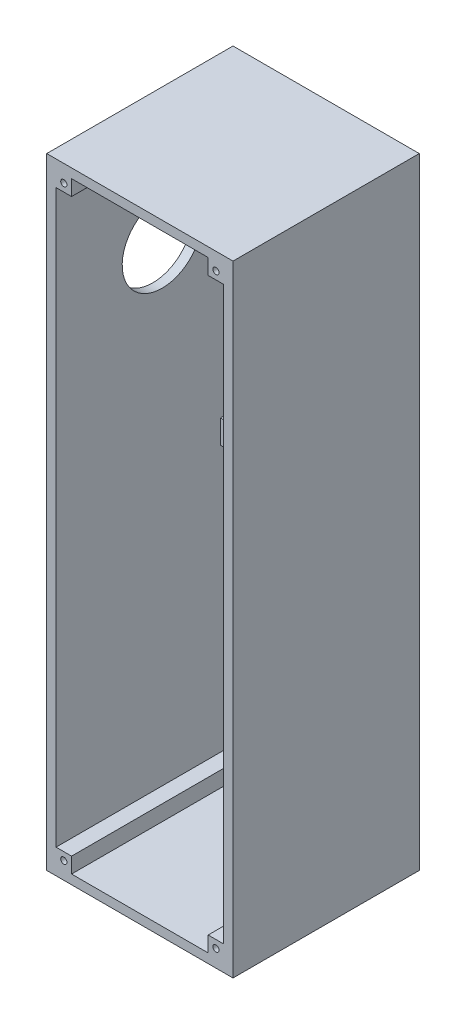
from build123d import *

# Parameters (mm, degrees)
SZKIC1_W                    = 60
SZKIC1_H                    = 60
DODANIE_WYCI_GNI_CIE1_DEPTH = 200
SKORUPA1_T                  = -3
SZKIC2_W                    = 5
SZKIC2_H                    = 5
SZKIC2_R                    = 1
DODANIE_WYCI_GNI_CIE5_DEPTH = 57
SZKIC3_W                    = 5
SZKIC3_H                    = 5
SZKIC3_R                    = 1
DODANIE_WYCI_GNI_CIE6_DEPTH = 57
SZKIC4_W                    = 5
SZKIC4_H                    = 5
SZKIC4_R                    = 1
DODANIE_WYCI_GNI_CIE7_DEPTH = 57
SZKIC5_W                    = 5
SZKIC5_H                    = 5
SZKIC5_R                    = 1
DODANIE_WYCI_GNI_CIE8_DEPTH = 57
SZKIC10_R                   = 12.875
WYTNIJ_WYCI_GNI_CIE3_DEPTH  = 3
SZKIC12_W                   = 31.15
SZKIC12_H                   = 7.6
DODANIE_WYCI_GNI_CIE9_DEPTH = 26.5
SZKIC13_R                   = 1.5
WYTNIJ_WYCI_GNI_CIE4_DEPTH  = 5
SZKIC15_R                   = 1.5
WYTNIJ_WYCI_GNI_CIE5_DEPTH  = 5
WYTNIJ_WYCI_GNI_CIE6_DEPTH  = 10
WYTNIJ_WYCI_GNI_CIE7_DEPTH  = 10


with BuildPart() as part:
    # Szkic1 → Dodanie-wyciągnięcie1 (new body)
    with BuildSketch(Plane(origin=(0, 0, 0), x_dir=(1, 0, 0), z_dir=(0, 1, 0))):
        with Locations((30, 30)):
            Rectangle(SZKIC1_W, SZKIC1_H)
    extrude(amount=DODANIE_WYCI_GNI_CIE1_DEPTH)

    # Skorupa1
    skorupa1_openings = [part.faces().sort_by_distance(p)[0] for p in [
        (30, 100, 0),
    ]]
    offset(amount=SKORUPA1_T, openings=skorupa1_openings, kind=Kind.INTERSECTION)

    # Szkic2 → Dodanie-wyciągnięcie5 (add)
    with BuildSketch(Plane.XY.offset(-57)):
        with Locations((5.5, 194.5)):
            Rectangle(SZKIC2_W, SZKIC2_H)
        with Locations(Location((5.5, 194.5, 0), (0, 0, 180))):
            Circle(SZKIC2_R, mode=Mode.SUBTRACT)
    extrude(amount=DODANIE_WYCI_GNI_CIE5_DEPTH)

    # Szkic3 → Dodanie-wyciągnięcie6 (add)
    with BuildSketch(Plane.XY.offset(-57)):
        with Locations((54.5, 194.5)):
            Rectangle(SZKIC3_W, SZKIC3_H)
        with Locations(Location((54.5, 194.5, 0), (0, 0, 180))):
            Circle(SZKIC3_R, mode=Mode.SUBTRACT)
    extrude(amount=DODANIE_WYCI_GNI_CIE6_DEPTH)

    # Szkic4 → Dodanie-wyciągnięcie7 (add)
    with BuildSketch(Plane.XY):
        with Locations((5.5, 5.5)):
            Rectangle(SZKIC4_W, SZKIC4_H)
        with Locations((5.5, 5.5)):
            Circle(SZKIC4_R, mode=Mode.SUBTRACT)
    extrude(amount=-DODANIE_WYCI_GNI_CIE7_DEPTH)

    # Szkic5 → Dodanie-wyciągnięcie8 (add)
    with BuildSketch(Plane.XY.offset(-57)):
        with Locations((54.5, 5.5)):
            Rectangle(SZKIC5_W, SZKIC5_H)
        with Locations(Location((54.5, 5.5, 0), (0, 0, 180))):
            Circle(SZKIC5_R, mode=Mode.SUBTRACT)
    extrude(amount=DODANIE_WYCI_GNI_CIE8_DEPTH)

    # Szkic10 → Wytnij-wyciągnięcie3 (cut)
    with BuildSketch(Plane.ZY):
        with Locations((-34.18, 159.72)):
            Circle(SZKIC10_R)
    extrude(amount=-WYTNIJ_WYCI_GNI_CIE3_DEPTH, mode=Mode.SUBTRACT)

    # Szkic12 → Dodanie-wyciągnięcie9 (add)
    with BuildSketch(Plane.ZY.offset(-57)):
        with Locations((-41.025, 173.56)):
            Rectangle(SZKIC12_W, SZKIC12_H)
        with Locations((-41.025, 124.96)):
            Rectangle(SZKIC12_W, SZKIC12_H)
    extrude(amount=DODANIE_WYCI_GNI_CIE9_DEPTH)

    # Szkic13 → Wytnij-wyciągnięcie4 (cut)
    with BuildSketch(Plane.ZY.offset(-30.5)):
        with Locations((-29.45, 175.36)):
            Circle(SZKIC13_R)
        with Locations((-39.1, 175.36)):
            Circle(SZKIC13_R)
    extrude(amount=-WYTNIJ_WYCI_GNI_CIE4_DEPTH, mode=Mode.SUBTRACT)

    # Szkic15 → Wytnij-wyciągnięcie5 (cut)
    with BuildSketch(Plane.ZY.offset(-30.5)):
        with Locations((-29.45, 124.16)):
            Circle(SZKIC15_R)
        with Locations((-39.1, 124.16)):
            Circle(SZKIC15_R)
    extrude(amount=-WYTNIJ_WYCI_GNI_CIE5_DEPTH, mode=Mode.SUBTRACT)

    # Szkic16 → Wytnij-wyciągnięcie6 (cut)
    with BuildSketch(Plane(origin=(0, 177.36, 0), x_dir=(1, 0, 0), z_dir=(0, 1, 0))):
        Polygon((57, 25.45), (57, 49.45), (47, 25.45), align=None)
    extrude(amount=-WYTNIJ_WYCI_GNI_CIE6_DEPTH, mode=Mode.SUBTRACT)

    # Szkic17 → Wytnij-wyciągnięcie7 (cut)
    with BuildSketch(Plane.ZY):
        with BuildLine():
            Line((-37.93, 172.345), (-37.93, 176.655))
            ThreePointArc((-37.93, 176.655), (-34.18, 180.405), (-30.43, 176.655))
            Line((-30.43, 176.655), (-30.43, 172.345))
            Line((-30.43, 172.345), (-30.43, 171.694400649))
            Line((-30.43, 171.694400649), (-37.93, 171.775211529))
            Line((-37.93, 171.775211529), (-37.93, 172.345))
        make_face()
    extrude(amount=-WYTNIJ_WYCI_GNI_CIE7_DEPTH, mode=Mode.SUBTRACT)


solid = part.part
